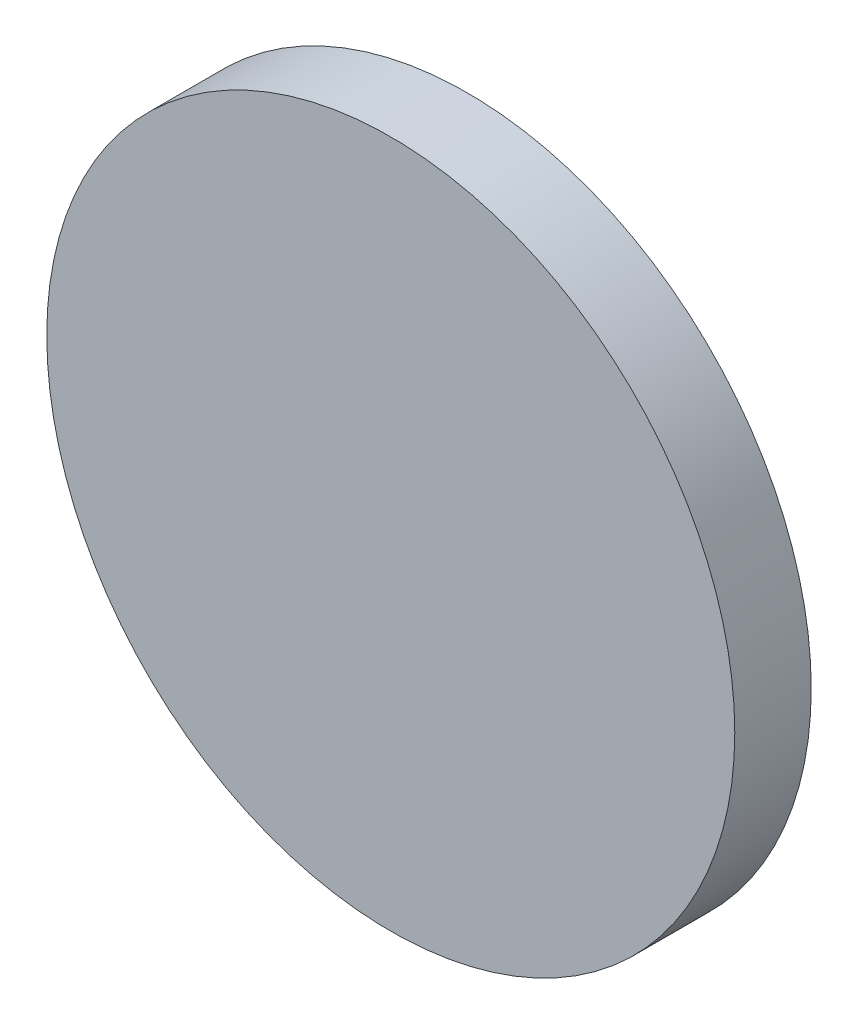
from build123d import *

# Parameters (mm, degrees)
SKETCH_1_R      = 45
EXTRUDE_1_DEPTH = 10


with BuildPart() as part:
    # 草图1 → 凸台-拉伸1 (new body)
    with BuildSketch(Plane.XY):
        Circle(SKETCH_1_R)
    extrude(amount=EXTRUDE_1_DEPTH)


solid = part.part
